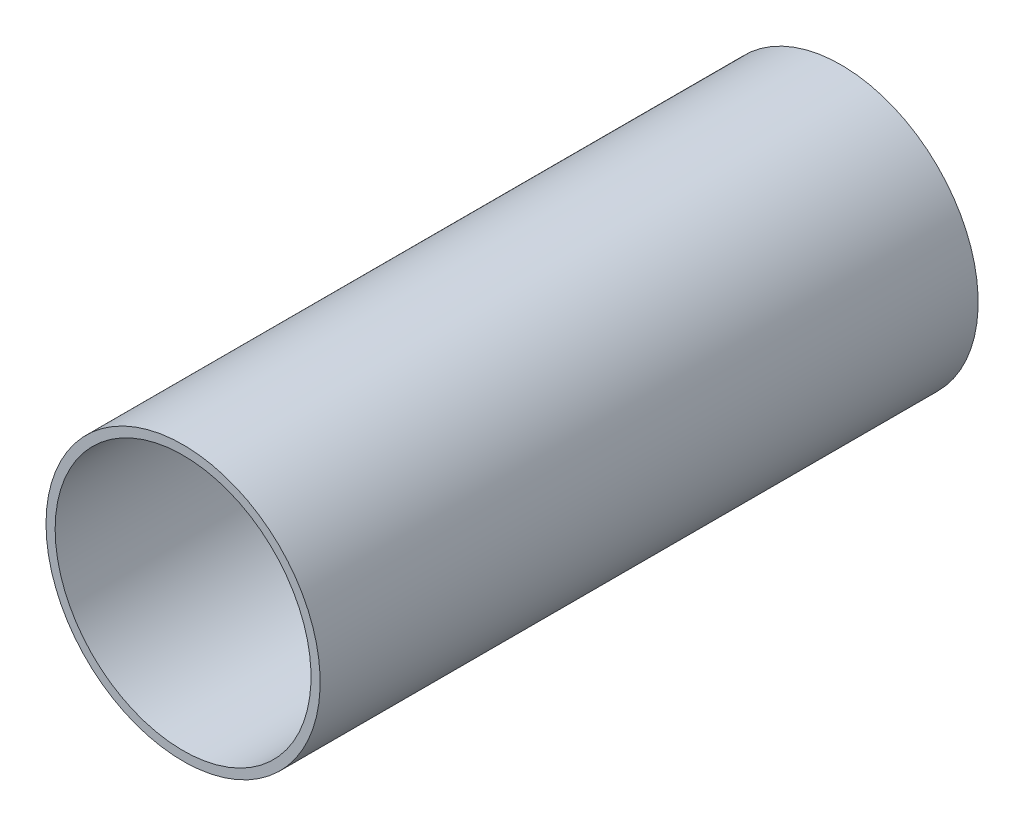
from build123d import *

# Parameters (mm, degrees)
ESBO_O1_R                = 75
ESBO_O1_R_2              = 70
RESSALTO_EXTRUS_O1_DEPTH = 360


with BuildPart() as part:
    # Esboço1 → Ressalto-extrusão1 (new body)
    with BuildSketch(Plane.XY):
        with Locations(Location((0, 0, 0), (0, 0, 180))):
            Circle(ESBO_O1_R)
        with Locations(Location((0, 0, 0), (0, 0, 180))):
            Circle(ESBO_O1_R_2, mode=Mode.SUBTRACT)
    extrude(amount=RESSALTO_EXTRUS_O1_DEPTH)


solid = part.part
